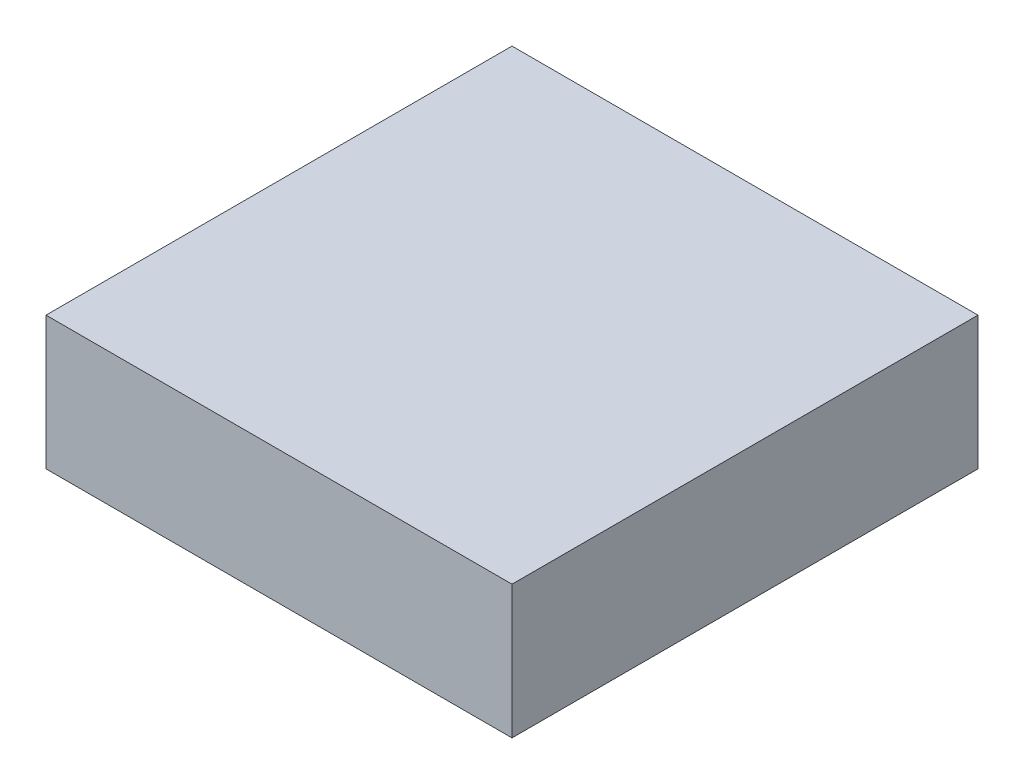
from build123d import *

# Parameters (mm, degrees)
SKETCH1_W           = 35
SKETCH1_H           = 35
BOSS_EXTRUDE1_DEPTH = 10


with BuildPart() as part:
    # Sketch1 → Boss-Extrude1 (new body)
    with BuildSketch(Plane(origin=(0, 0, 0), x_dir=(1, 0, 0), z_dir=(0, 1, 0))):
        Rectangle(SKETCH1_W, SKETCH1_H)
    extrude(amount=BOSS_EXTRUDE1_DEPTH)


solid = part.part
